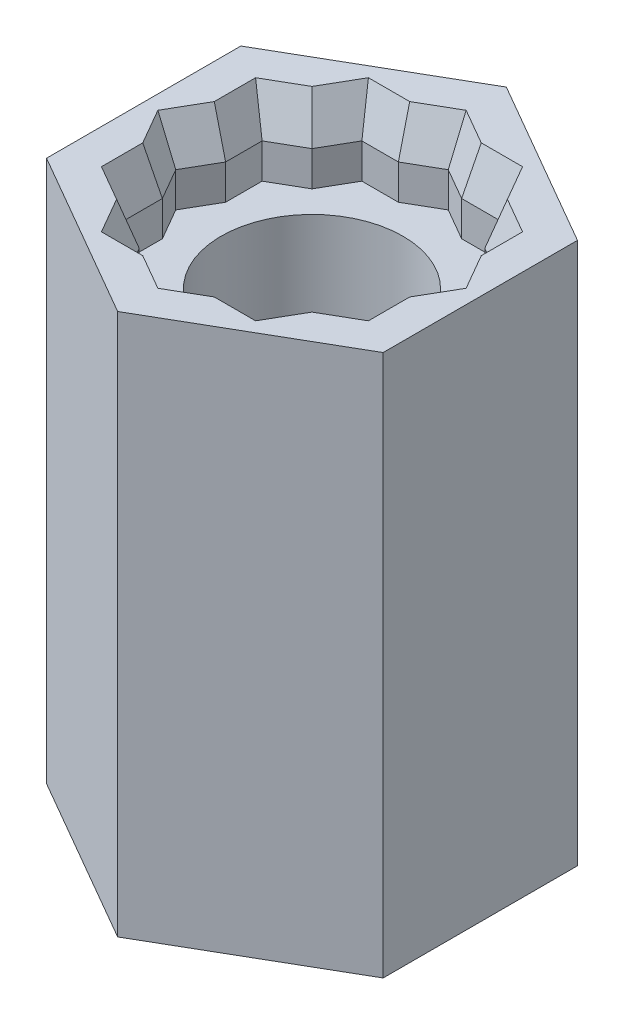
from build123d import *

# Parameters (mm, degrees)
BOSS_EXTRUDE1_DEPTH = 10
SKETCH2_R           = 11.75
BOSS_EXTRUDE2_DEPTH = 40
BOSS_EXTRUDE3_DEPTH = 20
CUT_EXTRUDE1_DEPTH  = 16
CUT_EXTRUDE2_DEPTH  = 10
CHAMFER1_SIZE       = 2
CHAMFER1_SIZE2      = 5.494954839


with BuildPart() as part:
    # Sketch1 → Boss-Extrude1 (new body)
    with BuildSketch(Plane(origin=(0, 0, 0), x_dir=(1, 0, 0), z_dir=(0, 1, 0))):
        Polygon((21.75, 12.557368355), (0, 25.11473671), (-21.75, 12.557368355), (-21.75, -12.557368355), (0, -25.11473671), (21.75, -12.557368355), align=None)
        Polygon((15.25, 8.804591605), (0, 17.60918321), (-15.25, 8.804591605), (-15.25, -8.804591605), (0, -17.60918321), (15.25, -8.804591605), align=None, mode=Mode.SUBTRACT)
    extrude(amount=BOSS_EXTRUDE1_DEPTH)

    # Sketch2 → Boss-Extrude2 (add)
    with BuildSketch(Plane.XZ):
        Polygon((21.75, 12.557368355), (0, 25.11473671), (-21.75, 12.557368355), (-21.75, -12.557368355), (0, -25.11473671), (21.75, -12.557368355), align=None)
        with Locations(Location((0, 0, 0), (0, 0, 270))):
            Circle(SKETCH2_R, mode=Mode.SUBTRACT)
    extrude(amount=BOSS_EXTRUDE2_DEPTH)

    # Sketch3 → Boss-Extrude3 (add)
    with BuildSketch(Plane.XZ.offset(40)):
        Polygon((21.75, 12.557368355), (0, 25.11473671), (-21.75, 12.557368355), (-21.75, -12.557368355), (0, -25.11473671), (21.75, -12.557368355), align=None)
    extrude(amount=BOSS_EXTRUDE3_DEPTH)

    # Sketch4 → Cut-Extrude1 (cut)
    with BuildSketch(Plane.XZ.offset(60)):
        with BuildLine():
            Line((-2.618090908, 1.66), (-2.618090908, -1.66))
            ThreePointArc((-2.618090908, -1.66), (3.1, 0), (-2.618090908, 1.66))
        make_face()
    extrude(amount=-CUT_EXTRUDE1_DEPTH, mode=Mode.SUBTRACT)

    # Sketch5 → Cut-Extrude2 (cut)
    with BuildSketch(Plane(origin=(0, 10, 0), x_dir=(1, 0, 0), z_dir=(0, 1, 0))):
        Polygon((8.804591605, 15.25), (-8.804591605, 15.25), (-17.60918321, 0), (-8.804591605, -15.25), (8.804591605, -15.25), (17.60918321, 0), align=None)
    extrude(amount=-CUT_EXTRUDE2_DEPTH, mode=Mode.SUBTRACT)

    # Chamfer1
    chamfer1_edges = [part.edges().sort_by_distance(p)[0] for p in [
        (-13.206887408, 10, -9.98418321),
        (2.043112592, 10, -16.429591605),
        (15.25, 10, -6.445408395),
        (16.429591605, 10, 2.043112592),
        (16.429591605, 10, -2.043112592),
        (9.98418321, 10, -13.206887408),
        (6.445408395, 10, -15.25),
        (-6.445408395, 10, -15.25),
        (-9.98418321, 10, -13.206887408),
        (-16.429591605, 10, -2.043112592),
        (-16.429591605, 10, 2.043112592),
        (-9.98418321, 10, 13.206887408),
        (-6.445408395, 10, 15.25),
        (6.445408395, 10, 15.25),
        (9.98418321, 10, 13.206887408),
        (15.25, 10, 6.445408395),
        (13.206887408, 10, -9.98418321),
        (-2.043112592, 10, -16.429591605),
        (-15.25, 10, -6.445408395),
        (-13.206887408, 10, 9.98418321),
        (2.043112592, 10, 16.429591605),
        (13.206887408, 10, 9.98418321),
        (-2.043112592, 10, 16.429591605),
        (-15.25, 10, 6.445408395),
    ]]
    chamfer1_side = [part.faces().sort_by_distance(p)[0] for p in [
        (10.542763262, 10, -18.260601622),
    ]]
    chamfer(chamfer1_edges, length=CHAMFER1_SIZE, length2=CHAMFER1_SIZE2, reference=chamfer1_side[0])


solid = part.part
